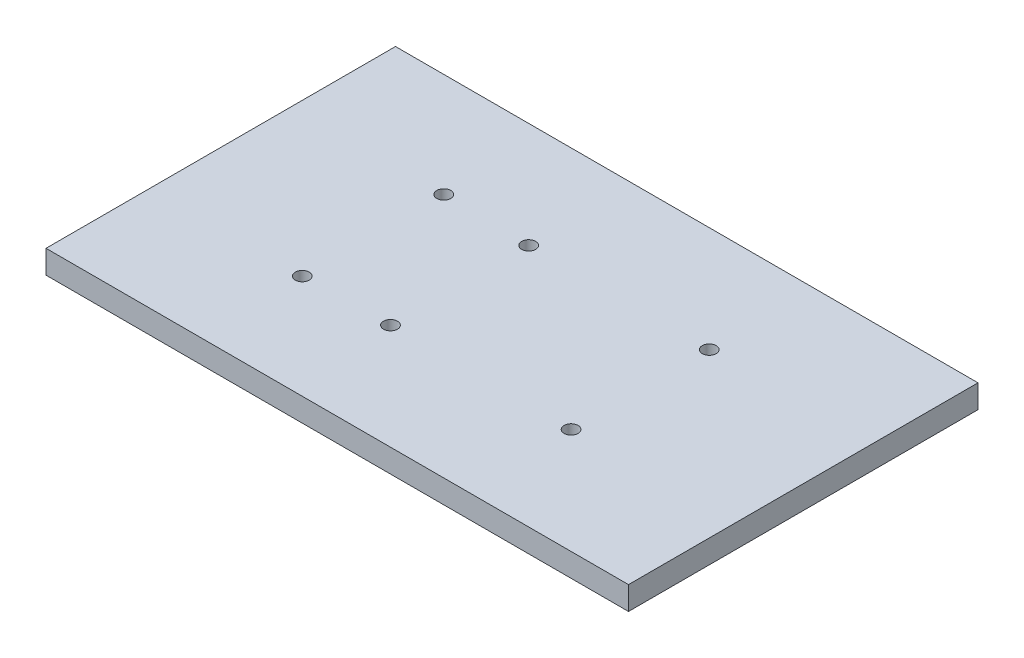
from build123d import *

# Parameters (mm, degrees)
SKETCH1_W           = 127
SKETCH1_H           = 76.2
BOSS_EXTRUDE1_DEPTH = 5.08
SKETCH3_R           = 1.524
CUT_EXTRUDE3_DEPTH  = 75.227127117
CHAMFER1_SIZE       = 0.254


with BuildPart() as part:
    # Sketch1 → Boss-Extrude1 (new body)
    with BuildSketch(Plane(origin=(0, 0, 0), x_dir=(1, 0, 0), z_dir=(0, 1, 0))):
        Rectangle(SKETCH1_W, SKETCH1_H)
    extrude(amount=BOSS_EXTRUDE1_DEPTH)

    # Sketch3 → Cut-Extrude3 (cut, through all)
    with BuildSketch(Plane(origin=(0, 5.08, 0), x_dir=(1, 0, 0), z_dir=(0, 1, 0))):
        with Locations(Location((-30.3022, -15.426316158, 0), (0, 0, 90))):
            Circle(SKETCH3_R)
        with Locations(Location((27.94, -15.0622, 0), (0, 0, 270))):
            Circle(SKETCH3_R)
        with Locations(Location((-11.43, -15.0622, 0), (0, 0, 270))):
            Circle(SKETCH3_R)
        with Locations(Location((27.94, 15.0622, 0), (0, 0, 270))):
            Circle(SKETCH3_R)
        with Locations(Location((-11.43, 15.0622, 0), (0, 0, 270))):
            Circle(SKETCH3_R)
        with Locations(Location((-30.3022, 15.426316158, 0), (0, 0, 270))):
            Circle(SKETCH3_R)
    extrude(amount=-CUT_EXTRUDE3_DEPTH, mode=Mode.SUBTRACT)

    # Chamfer1
    chamfer1_edges = [part.edges().sort_by_distance(p)[0] for p in [
        (-30.3022, 0, 16.950316158),
        (-11.43, 0, 13.5382),
        (-11.43, 0, -16.5862),
        (27.94, 0, 13.5382),
        (-30.3022, 0, -16.950316158),
        (27.94, 0, -16.5862),
    ]]
    chamfer(chamfer1_edges, length=CHAMFER1_SIZE)


solid = part.part
